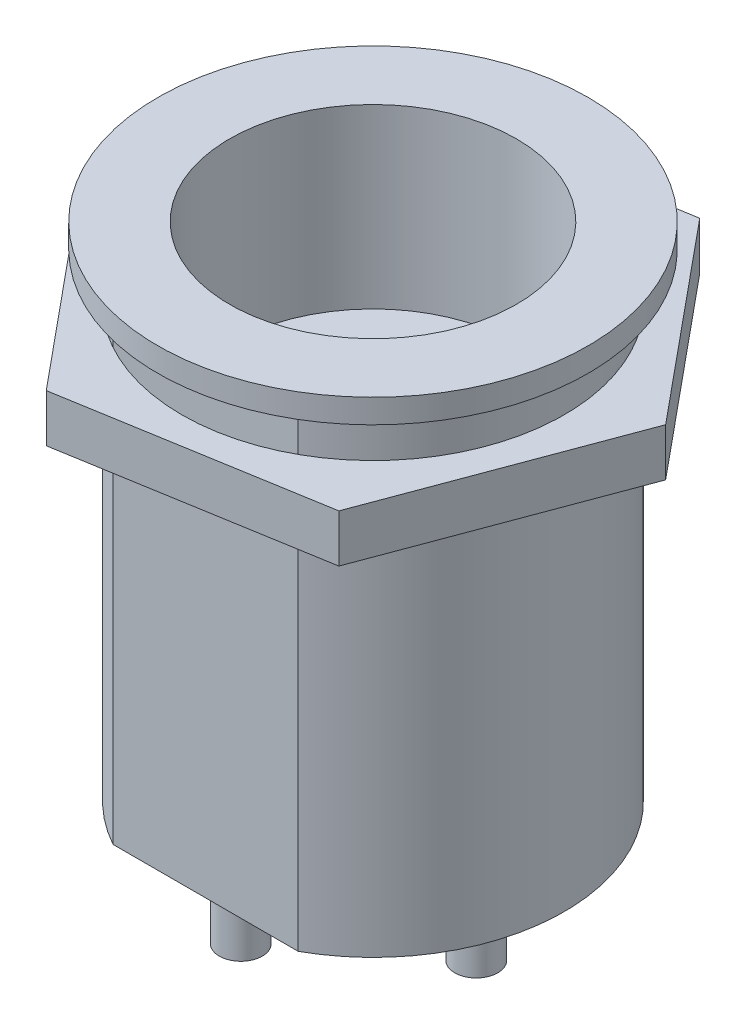
from build123d import *

# Parameters (mm, degrees)
BOSS_EXTRUDE1_START = -3
SKETCH3_R           = 8
BOSS_EXTRUDE1_DEPTH = 2
BOSS_EXTRUDE2_START = -21
SKETCH4_R           = 0.900373239
BOSS_EXTRUDE2_DEPTH = 3
CIRPATTERN1_COUNT   = 4
CUT_EXTRUDE1_START  = -1
SKETCH5_W           = 102.873705044
SKETCH5_H           = 65.633954552
SKETCH5_W_2         = 44.050821248
SKETCH5_H_2         = 14
CUT_EXTRUDE1_DEPTH  = 28.016006623


with BuildPart() as part:
    # Sketch1 → Revolve1 (revolve)
    with BuildSketch(Plane.XY, mode=Mode.PRIVATE) as revolve1_sk:
        Polygon((-9, 0), (-6, 0), (-6, -7.406387496), (0, -7.406387496), (0, -21), (-8, -21), (-8, -1), (-9, -1), align=None)
    revolve(revolve1_sk.sketch.rotate(Axis((0, 0, 0), (0, 1, 0)), 270), axis=Axis((0, 0, 0), (0, 1, 0)))

    # Sketch4 → Boss-Extrude2 (add)
    with BuildSketch(Plane(origin=(0, 0, 0), x_dir=(1, 0, 0), z_dir=(0, 1, 0)).offset(BOSS_EXTRUDE2_START)):
        with Locations(Location((0.604814269, 4.924916191, 0), (0, 0, 270))):
            Circle(SKETCH4_R)
    boss_extrude2 = extrude(amount=-BOSS_EXTRUDE2_DEPTH)

    # CirPattern1: Boss-Extrude2 ×4 about axis
    cirpattern1_axis = Axis((0, 0, 0), (0, 1, 0))
    for i in range(1, CIRPATTERN1_COUNT):
        add(boss_extrude2.rotate(cirpattern1_axis, i * 360 / CIRPATTERN1_COUNT))

    # Sketch5 → Cut-Extrude1 (cut, through all)
    with BuildSketch(Plane(origin=(0, 0, 0), x_dir=(1, 0, 0), z_dir=(0, 1, 0)).offset(CUT_EXTRUDE1_START)):
        Rectangle(SKETCH5_W, SKETCH5_H)
        Rectangle(SKETCH5_W_2, SKETCH5_H_2, mode=Mode.SUBTRACT)
    extrude(amount=-CUT_EXTRUDE1_DEPTH, mode=Mode.SUBTRACT)


with BuildPart() as body_2:
    # Sketch3 → Boss-Extrude1 (new body)
    with BuildSketch(Plane(origin=(0, 0, 0), x_dir=(1, 0, 0), z_dir=(0, 1, 0)).offset(BOSS_EXTRUDE1_START)):
        Polygon((10.477779005, 1.763034167), (3.712057126, 9.955539877), (-6.765721879, 8.19250571), (-10.477779005, -1.763034167), (-3.712057126, -9.955539877), (6.765721879, -8.19250571), align=None)
        with Locations(Location((0, 0, 0), (0, 0, 270))):
            Circle(SKETCH3_R, mode=Mode.SUBTRACT)
    extrude(amount=-BOSS_EXTRUDE1_DEPTH)


solid = Compound([part.part, body_2.part])
